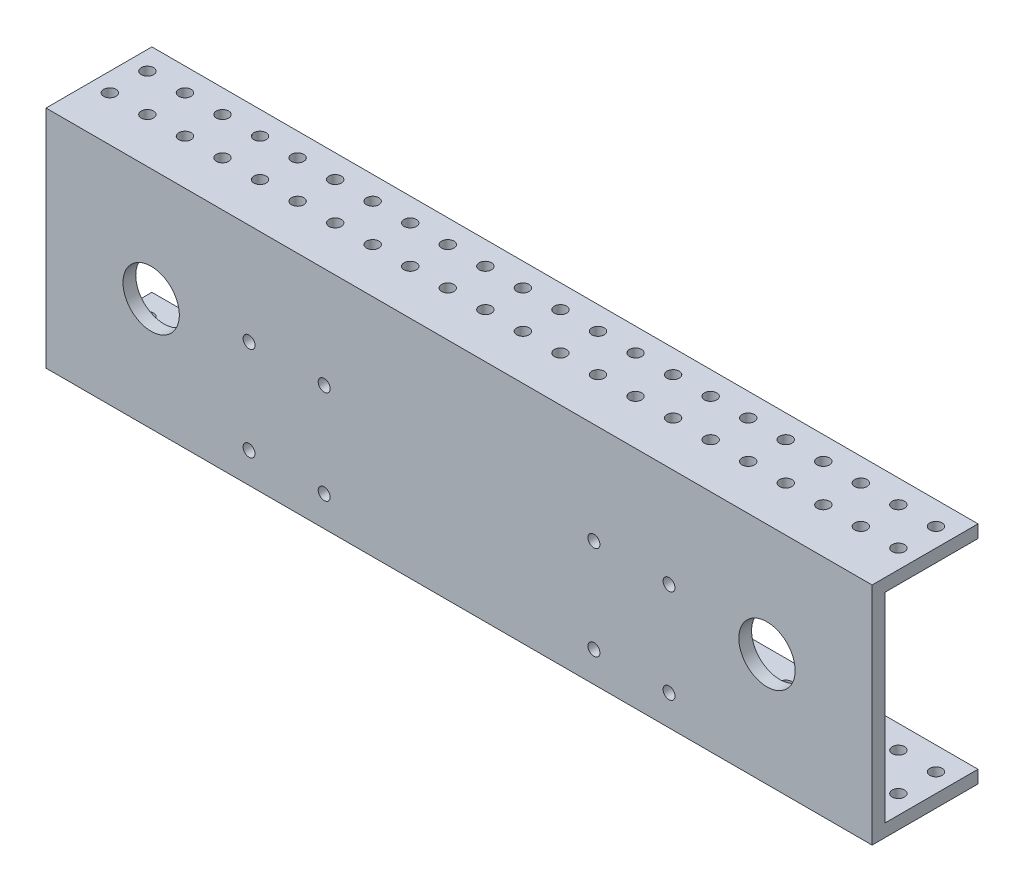
from build123d import *

# Parameters (mm, degrees)
BOSS_EXTRUDE1_DEPTH = 139.7
SKETCH2_R           = 2.0828
CUT_EXTRUDE1_DEPTH  = 164.110921143
CUT_EXTRUDE3_REACH  = 151.165
SKETCH4_R           = 2.0193
SKETCH5_R           = 9.525
CUT_EXTRUDE4_DEPTH  = 149.188049505


with BuildPart() as part:
    # Sketch1 → Boss-Extrude1 (new, symmetric)
    with BuildSketch(Plane(origin=(0, 0, 0), x_dir=(0, 0, -1), z_dir=(1, 0, 0))):
        Polygon((0, 38.1), (0, -38.1), (35.814, -38.1), (35.814, -33.782), (4.318, -33.782), (4.318, 33.782), (35.814, 33.782), (35.814, 38.1), align=None)
    extrude(amount=BOSS_EXTRUDE1_DEPTH, both=True)

    # Sketch2 → Cut-Extrude1 (cut, through all)
    with BuildSketch(Plane(origin=(0, 38.1, 0), x_dir=(1, 0, 0), z_dir=(0, 1, 0))):
        with Locations(Location((-133.35, 27.94, 0), (0, 0, 270))):
            Circle(SKETCH2_R)
        with Locations(Location((-133.35, 15.24, 0), (0, 0, 270))):
            Circle(SKETCH2_R)
        with Locations(Location((-120.65, 27.94, 0), (0, 0, 270))):
            Circle(SKETCH2_R)
        with Locations(Location((-120.65, 15.24, 0), (0, 0, 270))):
            Circle(SKETCH2_R)
        with Locations(Location((-107.95, 27.94, 0), (0, 0, 270))):
            Circle(SKETCH2_R)
        with Locations(Location((-107.95, 15.24, 0), (0, 0, 270))):
            Circle(SKETCH2_R)
        with Locations(Location((-95.25, 27.94, 0), (0, 0, 270))):
            Circle(SKETCH2_R)
        with Locations(Location((-95.25, 15.24, 0), (0, 0, 270))):
            Circle(SKETCH2_R)
        with Locations(Location((-82.55, 27.94, 0), (0, 0, 270))):
            Circle(SKETCH2_R)
        with Locations(Location((-82.55, 15.24, 0), (0, 0, 270))):
            Circle(SKETCH2_R)
        with Locations(Location((-69.85, 27.94, 0), (0, 0, 270))):
            Circle(SKETCH2_R)
        with Locations(Location((-69.85, 15.24, 0), (0, 0, 270))):
            Circle(SKETCH2_R)
        with Locations(Location((-57.15, 27.94, 0), (0, 0, 270))):
            Circle(SKETCH2_R)
        with Locations(Location((-57.15, 15.24, 0), (0, 0, 270))):
            Circle(SKETCH2_R)
        with Locations(Location((-44.45, 27.94, 0), (0, 0, 270))):
            Circle(SKETCH2_R)
        with Locations(Location((-44.45, 15.24, 0), (0, 0, 270))):
            Circle(SKETCH2_R)
        with Locations(Location((-31.75, 27.94, 0), (0, 0, 270))):
            Circle(SKETCH2_R)
        with Locations(Location((-31.75, 15.24, 0), (0, 0, 270))):
            Circle(SKETCH2_R)
        with Locations(Location((-19.05, 27.94, 0), (0, 0, 270))):
            Circle(SKETCH2_R)
        with Locations(Location((-19.05, 15.24, 0), (0, 0, 270))):
            Circle(SKETCH2_R)
        with Locations(Location((-6.35, 27.94, 0), (0, 0, 270))):
            Circle(SKETCH2_R)
        with Locations(Location((-6.35, 15.24, 0), (0, 0, 270))):
            Circle(SKETCH2_R)
        with Locations(Location((6.35, 27.94, 0), (0, 0, 270))):
            Circle(SKETCH2_R)
        with Locations(Location((6.35, 15.24, 0), (0, 0, 270))):
            Circle(SKETCH2_R)
        with Locations(Location((19.05, 27.94, 0), (0, 0, 270))):
            Circle(SKETCH2_R)
        with Locations(Location((19.05, 15.24, 0), (0, 0, 270))):
            Circle(SKETCH2_R)
        with Locations(Location((31.75, 27.94, 0), (0, 0, 270))):
            Circle(SKETCH2_R)
        with Locations(Location((31.75, 15.24, 0), (0, 0, 270))):
            Circle(SKETCH2_R)
        with Locations(Location((44.45, 27.94, 0), (0, 0, 270))):
            Circle(SKETCH2_R)
        with Locations(Location((44.45, 15.24, 0), (0, 0, 270))):
            Circle(SKETCH2_R)
        with Locations(Location((57.15, 27.94, 0), (0, 0, 270))):
            Circle(SKETCH2_R)
        with Locations(Location((57.15, 15.24, 0), (0, 0, 270))):
            Circle(SKETCH2_R)
        with Locations(Location((69.85, 27.94, 0), (0, 0, 270))):
            Circle(SKETCH2_R)
        with Locations(Location((69.85, 15.24, 0), (0, 0, 270))):
            Circle(SKETCH2_R)
        with Locations(Location((82.55, 27.94, 0), (0, 0, 270))):
            Circle(SKETCH2_R)
        with Locations(Location((82.55, 15.24, 0), (0, 0, 270))):
            Circle(SKETCH2_R)
        with Locations(Location((95.25, 27.94, 0), (0, 0, 270))):
            Circle(SKETCH2_R)
        with Locations(Location((95.25, 15.24, 0), (0, 0, 270))):
            Circle(SKETCH2_R)
        with Locations(Location((107.95, 27.94, 0), (0, 0, 270))):
            Circle(SKETCH2_R)
        with Locations(Location((107.95, 15.24, 0), (0, 0, 270))):
            Circle(SKETCH2_R)
        with Locations(Location((120.65, 27.94, 0), (0, 0, 270))):
            Circle(SKETCH2_R)
        with Locations(Location((120.65, 15.24, 0), (0, 0, 270))):
            Circle(SKETCH2_R)
        with Locations(Location((133.35, 27.94, 0), (0, 0, 270))):
            Circle(SKETCH2_R)
        with Locations(Location((133.35, 15.24, 0), (0, 0, 270))):
            Circle(SKETCH2_R)
    extrude(amount=-CUT_EXTRUDE1_DEPTH, mode=Mode.SUBTRACT)

    # Sketch4 → Cut-Extrude3 (cut, up to next)
    with BuildSketch(Plane.XY, mode=Mode.PRIVATE) as cut_extrude3_sk1:
        with Locations((-71.016697469, 3.925)):
            Circle(SKETCH4_R)
    cut_extrude3_tool1 = extrude(cut_extrude3_sk1.sketch, amount=-CUT_EXTRUDE3_REACH, mode=Mode.PRIVATE) & part.part
    # Sketch4 → Cut-Extrude3 (cut, up to next)
    with BuildSketch(Plane.XY, mode=Mode.PRIVATE) as cut_extrude3_sk2:
        with Locations((-45.616697469, -27.825)):
            Circle(SKETCH4_R)
    cut_extrude3_tool2 = extrude(cut_extrude3_sk2.sketch, amount=-CUT_EXTRUDE3_REACH, mode=Mode.PRIVATE) & part.part
    # Sketch4 → Cut-Extrude3 (cut, up to next)
    with BuildSketch(Plane.XY, mode=Mode.PRIVATE) as cut_extrude3_sk3:
        with Locations((-45.616697469, 3.925)):
            Circle(SKETCH4_R)
    cut_extrude3_tool3 = extrude(cut_extrude3_sk3.sketch, amount=-CUT_EXTRUDE3_REACH, mode=Mode.PRIVATE) & part.part
    # Sketch4 → Cut-Extrude3 (cut, up to next)
    with BuildSketch(Plane.XY, mode=Mode.PRIVATE) as cut_extrude3_sk4:
        with Locations((-71.016697469, -27.825)):
            Circle(SKETCH4_R)
    cut_extrude3_tool4 = extrude(cut_extrude3_sk4.sketch, amount=-CUT_EXTRUDE3_REACH, mode=Mode.PRIVATE) & part.part
    # Sketch4 → Cut-Extrude3 (cut, up to next)
    with BuildSketch(Plane.XY, mode=Mode.PRIVATE) as cut_extrude3_sk5:
        with Locations((45.616697469, -27.825)):
            Circle(SKETCH4_R)
    cut_extrude3_tool5 = extrude(cut_extrude3_sk5.sketch, amount=-CUT_EXTRUDE3_REACH, mode=Mode.PRIVATE) & part.part
    # Sketch4 → Cut-Extrude3 (cut, up to next)
    with BuildSketch(Plane.XY, mode=Mode.PRIVATE) as cut_extrude3_sk6:
        with Locations((71.016697469, -27.825)):
            Circle(SKETCH4_R)
    cut_extrude3_tool6 = extrude(cut_extrude3_sk6.sketch, amount=-CUT_EXTRUDE3_REACH, mode=Mode.PRIVATE) & part.part
    # Sketch4 → Cut-Extrude3 (cut, up to next)
    with BuildSketch(Plane.XY, mode=Mode.PRIVATE) as cut_extrude3_sk7:
        with Locations((71.016697469, 3.925)):
            Circle(SKETCH4_R)
    cut_extrude3_tool7 = extrude(cut_extrude3_sk7.sketch, amount=-CUT_EXTRUDE3_REACH, mode=Mode.PRIVATE) & part.part
    # Sketch4 → Cut-Extrude3 (cut, up to next)
    with BuildSketch(Plane.XY, mode=Mode.PRIVATE) as cut_extrude3_sk8:
        with Locations((45.616697469, 3.925)):
            Circle(SKETCH4_R)
    cut_extrude3_tool8 = extrude(cut_extrude3_sk8.sketch, amount=-CUT_EXTRUDE3_REACH, mode=Mode.PRIVATE) & part.part
    add(cut_extrude3_tool1.solids().sort_by_distance((-71.016697, 3.925, 0))[0], mode=Mode.SUBTRACT)
    add(cut_extrude3_tool2.solids().sort_by_distance((-45.616697, -27.825, 0))[0], mode=Mode.SUBTRACT)
    add(cut_extrude3_tool3.solids().sort_by_distance((-45.616697, 3.925, 0))[0], mode=Mode.SUBTRACT)
    add(cut_extrude3_tool4.solids().sort_by_distance((-71.016697, -27.825, 0))[0], mode=Mode.SUBTRACT)
    add(cut_extrude3_tool5.solids().sort_by_distance((45.616697, -27.825, 0))[0], mode=Mode.SUBTRACT)
    add(cut_extrude3_tool6.solids().sort_by_distance((71.016697, -27.825, 0))[0], mode=Mode.SUBTRACT)
    add(cut_extrude3_tool7.solids().sort_by_distance((71.016697, 3.925, 0))[0], mode=Mode.SUBTRACT)
    add(cut_extrude3_tool8.solids().sort_by_distance((45.616697, 3.925, 0))[0], mode=Mode.SUBTRACT)

    # Sketch5 → Cut-Extrude4 (cut, through all)
    with BuildSketch(Plane(origin=(0, 0, -4.318), x_dir=(-1, 0, 0), z_dir=(0, 0, -1))):
        with Locations((104.14, 0)):
            Circle(SKETCH5_R)
        with Locations((-104.14, 0)):
            Circle(SKETCH5_R)
    extrude(amount=-CUT_EXTRUDE4_DEPTH, mode=Mode.SUBTRACT)


solid = part.part
